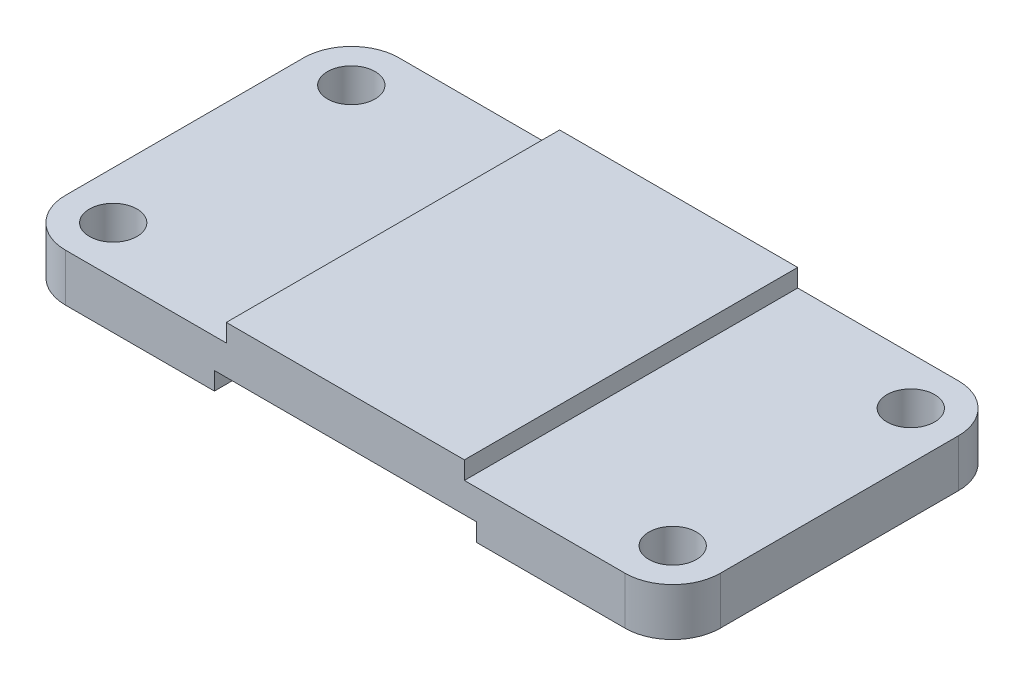
from build123d import *

# Parameters (mm, degrees)
IZIM1_R                     = 40
Y_KSEKLIK_EKSTR_ZYON1_DEPTH = 80
IZIM2_W                     = 440
IZIM2_H                     = 30
KES_EKSTR_ZYON1_DEPTH       = 789.986691903
IZIM3_W                     = 400
IZIM3_H                     = 30
Y_KSEKLIK_EKSTR_ZYON2_DEPTH = 560


with BuildPart() as part:
    # Çizim1 → Yükseklik-Ekstrüzyon1 (new body)
    with BuildSketch(Plane(origin=(0, 0, 0), x_dir=(1, 0, 0), z_dir=(0, 1, 0))):
        with BuildLine():
            Line((-470, -280), (470, -280))
            ThreePointArc((470, -280), (526.568542495, -256.568542495), (550, -200))
            Line((550, -200), (550, 200))
            ThreePointArc((550, 200), (526.568542495, 256.568542495), (470, 280))
            Line((470, 280), (-470, 280))
            ThreePointArc((-470, 280), (-526.568542495, 256.568542495), (-550, 200))
            Line((-550, 200), (-550, -200))
            ThreePointArc((-550, -200), (-526.568542495, -256.568542495), (-470, -280))
        make_face()
        with Locations(Location((-470, 200, 0), (0, 0, 270))):
            Circle(IZIM1_R, mode=Mode.SUBTRACT)
        with Locations(Location((-470, -200, 0), (0, 0, 270))):
            Circle(IZIM1_R, mode=Mode.SUBTRACT)
        with Locations(Location((470, -200, 0), (0, 0, 270))):
            Circle(IZIM1_R, mode=Mode.SUBTRACT)
        with Locations(Location((470, 200, 0), (0, 0, 270))):
            Circle(IZIM1_R, mode=Mode.SUBTRACT)
    extrude(amount=Y_KSEKLIK_EKSTR_ZYON1_DEPTH)

    # Çizim2 → Kes-Ekstrüzyon1 (cut, through all)
    with BuildSketch(Plane.XY.offset(280)):
        with Locations((0, 15)):
            Rectangle(IZIM2_W, IZIM2_H)
    extrude(amount=-KES_EKSTR_ZYON1_DEPTH, mode=Mode.SUBTRACT)

    # Çizim3 → Yükseklik-Ekstrüzyon2 (add)
    with BuildSketch(Plane.XY.offset(280)):
        with Locations((0, 95)):
            Rectangle(IZIM3_W, IZIM3_H)
    extrude(amount=-Y_KSEKLIK_EKSTR_ZYON2_DEPTH)


solid = part.part
